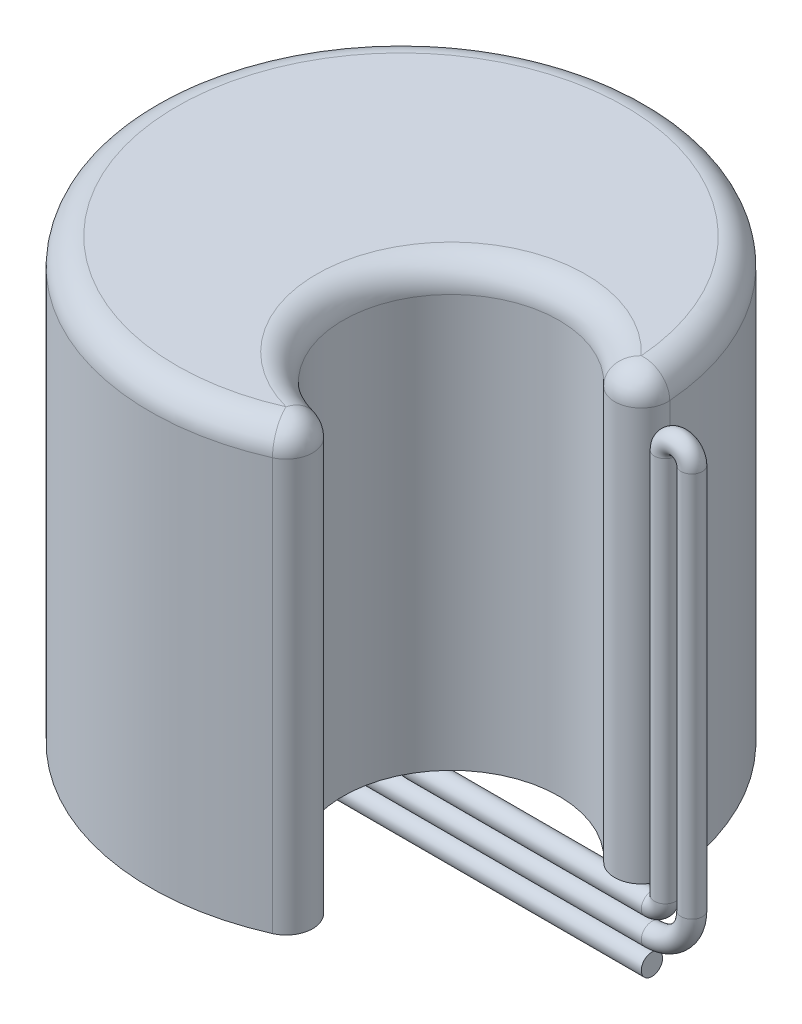
from build123d import *

# Parameters (mm, degrees)
SKETCH1_W          = 59.928125
SKETCH1_H          = 104.775
SKETCH13_R         = 2.54
CUT_EXTRUDE2_DEPTH = 104.775
FILLET1_R          = 6.35


with BuildPart() as part:
    # Sketch1 → Revolve1 (revolve)
    with BuildSketch(Plane.XY, mode=Mode.PRIVATE) as revolve1_sk:
        with Locations((29.9640625, 52.3875)):
            Rectangle(SKETCH1_W, SKETCH1_H)
    revolve(revolve1_sk.sketch.rotate(Axis((0, 0, 0), (0, 1, 0)), 90), axis=Axis((0, 0, 0), (0, 1, 0)))

    # Sweep2: sweep along a path in Sketch12
    with BuildLine(Plane.XY) as sweep2_path:
        Line((59.928125, -15.875), (-56.753125, -15.875))
        ThreePointArc((-56.753125, -15.875), (-59.928125, -12.7), (-56.753125, -9.525))
        Line((-56.753125, -9.525), (59.928125, -9.525))
        ThreePointArc((59.928125, -9.525), (66.663317091, -6.735192091), (69.453125, 0))
        Line((69.453125, 0), (69.453125, 92.075))
        ThreePointArc((69.453125, 92.075), (66.278125, 95.25), (63.103125, 92.075))
        Line((63.103125, 92.075), (63.103125, 0))
        ThreePointArc((63.103125, 0), (62.17318903, -2.24506403), (59.928125, -3.175))
        Line((59.928125, -3.175), (3.175, -3.175))
        ThreePointArc((3.175, -3.175), (0.92993597, -2.24506403), (0, 0))
    # Sketch13 → Sweep2 (sweep)
    with BuildSketch(Plane.XZ):
        Circle(SKETCH13_R)
    sweep(path=sweep2_path.line)

    # Sketch14 → Cut-Extrude2 (cut)
    with BuildSketch(Plane(origin=(0, 104.775, 0), x_dir=(1, 0, 0), z_dir=(0, 1, 0))):
        with BuildLine():
            ThreePointArc((48.79102599, -0.381223778), (7.824330267, -4.701331928), (23.242599838, -42.900945228))
            ThreePointArc((23.242599838, -42.900945228), (27.926437111, -48.550161742), (24.154243919, -54.844805285))
            ThreePointArc((24.154243919, -54.844805285), (51.368429142, -30.865266133), (59.764819448, 4.421144922))
            ThreePointArc((59.764819448, 4.421144922), (55.977916516, -1.864660118), (48.79102599, -0.381223778))
        make_face()
    extrude(amount=-CUT_EXTRUDE2_DEPTH, mode=Mode.SUBTRACT)

    # Fillet1
    fillet1_edges = [part.edges().sort_by_distance(p)[0] for p in [
        (-51.368429142, 104.775, -30.865266133),
        (55.977916516, 104.775, 1.864660118),
        (7.824330267, 104.775, 4.701331928),
        (27.926437111, 104.775, 48.550161742),
    ]]
    fillet(fillet1_edges, radius=FILLET1_R)


solid = part.part
